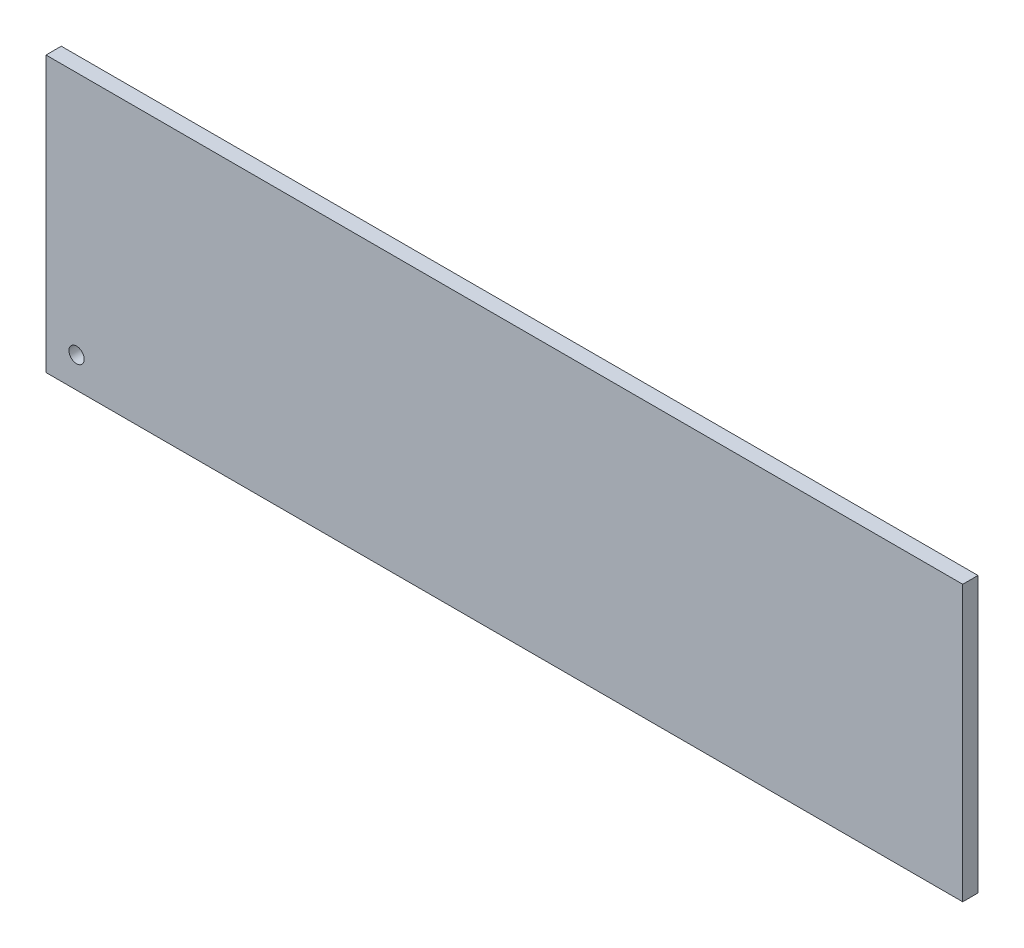
from build123d import *

# Parameters (mm, degrees)
ESQUISSE1_W             = 300
ESQUISSE1_H             = 90
BOSS_EXTRU_1_DEPTH      = 2.5
ESQUISSE2_R             = 2.5
ENL_V_MAT_EXTRU_1_DEPTH = 314.249102154


with BuildPart() as part:
    # Esquisse1 → Boss.-Extru.1 (new, symmetric)
    with BuildSketch(Plane.XY):
        with Locations((150, 45)):
            Rectangle(ESQUISSE1_W, ESQUISSE1_H)
    extrude(amount=BOSS_EXTRU_1_DEPTH, both=True)

    # Esquisse2 → Enlèv. mat.-Extru.1 (cut, through all)
    with BuildSketch(Plane.XY.offset(2.5)):
        with Locations((10, 10)):
            Circle(ESQUISSE2_R)
    extrude(amount=-ENL_V_MAT_EXTRU_1_DEPTH, mode=Mode.SUBTRACT)


solid = part.part
